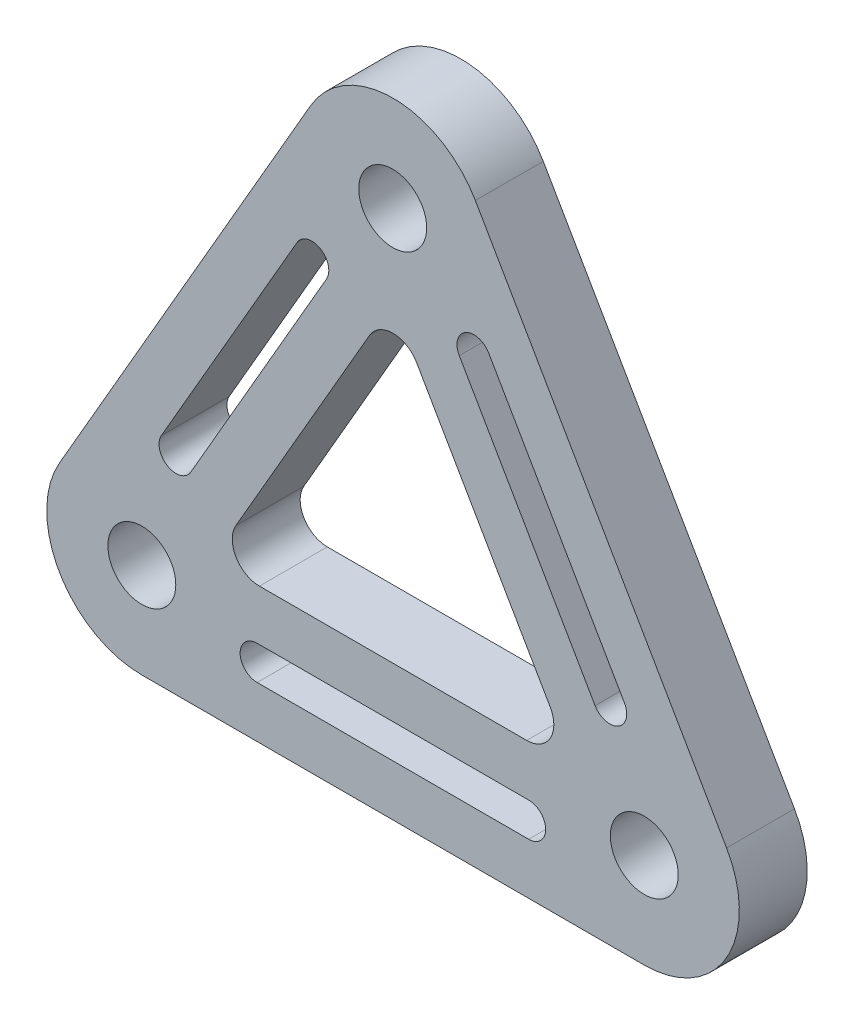
from build123d import *

# Parameters (mm, degrees)
SKETCH1_R           = 4.7625
BOSS_EXTRUDE1_DEPTH = 6.35
BOSS_EXTRUDE2_START = -6.35
SKETCH2_R           = 4.7625
SKETCH2_R_2         = 3.175
BOSS_EXTRUDE2_DEPTH = 6.35
CUT_EXTRUDE1_DEPTH  = 6.35


with BuildPart() as part:
    # Sketch1 → Boss-Extrude1 (new body)
    with BuildSketch(Plane.XY):
        with BuildLine():
            Line((31.405613519, -6.275848049), (7.910613519, -46.970381773))
            ThreePointArc((7.910613519, -46.970381773), (7.910613519, -55.860381773), (15.609579358, -60.305381773))
            Line((15.609579358, -60.305381773), (62.599579358, -60.305381773))
            ThreePointArc((62.599579358, -60.305381773), (70.298545198, -55.860381773), (70.298545198, -46.970381773))
            Line((70.298545198, -46.970381773), (46.803545198, -6.275848049))
            ThreePointArc((46.803545198, -6.275848049), (39.104579358, -1.830848049), (31.405613519, -6.275848049))
        make_face()
        with Locations((39.073094298, -10.775381773)):
            Circle(SKETCH1_R, mode=Mode.SUBTRACT)
        with Locations((15.609579358, -51.415381773)):
            Circle(SKETCH1_R, mode=Mode.SUBTRACT)
        with Locations((62.599579358, -51.415381773)):
            Circle(SKETCH1_R, mode=Mode.SUBTRACT)
        with BuildLine():
            Line((36.904874833, -22.150848049), (24.408397461, -43.795381773))
            ThreePointArc((24.408397461, -43.795381773), (24.408397461, -46.335381773), (26.608101987, -47.605381773))
            Line((26.608101987, -47.605381773), (51.60105673, -47.605381773))
            ThreePointArc((51.60105673, -47.605381773), (53.800761256, -46.335381773), (53.800761256, -43.795381773))
            Line((53.800761256, -43.795381773), (41.304283884, -22.150848049))
            ThreePointArc((41.304283884, -22.150848049), (39.104579358, -20.880848049), (36.904874833, -22.150848049))
        make_face(mode=Mode.SUBTRACT)
    extrude(amount=BOSS_EXTRUDE1_DEPTH)

    # Sketch2 → Boss-Extrude2 (add)
    # profile 1 of 3: a face of its own
    with BuildSketch(Plane.XY.offset(6.35).offset(BOSS_EXTRUDE2_START)):
        with Locations((39.073094298, -10.775381773)):
            Circle(SKETCH2_R)
        with Locations((39.073094298, -10.775381773)):
            Circle(SKETCH2_R_2, mode=Mode.SUBTRACT)
    # profile 2 of 3: a face of its own
    with BuildSketch(Plane.XY.offset(6.35).offset(BOSS_EXTRUDE2_START)):
        with Locations((62.599579358, -51.415381773)):
            Circle(SKETCH2_R)
        with Locations((62.599579358, -51.415381773)):
            Circle(SKETCH2_R_2, mode=Mode.SUBTRACT)
    # profile 3 of 3: a face of its own
    with BuildSketch(Plane.XY.offset(6.35).offset(BOSS_EXTRUDE2_START)):
        with Locations((15.609579358, -51.415381773)):
            Circle(SKETCH2_R)
        with Locations((15.609579358, -51.415381773)):
            Circle(SKETCH2_R_2, mode=Mode.SUBTRACT)
    extrude(amount=BOSS_EXTRUDE2_DEPTH)

    # Sketch3 → Cut-Extrude1 (cut)
    with BuildSketch(Plane.XY.offset(6.35)):
        with BuildLine():
            Line((30.132559504, -18.005842283), (17.432559504, -40.002887539))
            ThreePointArc((17.432559504, -40.002887539), (18.013624833, -42.171452868), (20.182190161, -41.590387539))
            Line((20.182190161, -41.590387539), (32.882190161, -19.593342283))
            ThreePointArc((32.882190161, -19.593342283), (33.040782082, -18.388717049), (32.301124833, -17.424776955))
            ThreePointArc((32.301124833, -17.424776955), (31.096499599, -17.266185034), (30.132559504, -18.005842283))
        make_face()
        with BuildLine():
            Line((60.748040695, -40.002887539), (48.048040695, -18.005842283))
            ThreePointArc((48.048040695, -18.005842283), (45.879475366, -17.424776955), (45.298410038, -19.593342283))
            Line((45.298410038, -19.593342283), (57.998410038, -41.590387539))
            ThreePointArc((57.998410038, -41.590387539), (60.166975366, -42.171452868), (60.748040695, -40.002887539))
        make_face()
        with BuildLine():
            Line((26.390300099, -55.518149371), (51.790300099, -55.518149371))
            ThreePointArc((51.790300099, -55.518149371), (53.377800099, -53.930649371), (51.790300099, -52.343149371))
            Line((51.790300099, -52.343149371), (26.390300099, -52.343149371))
            ThreePointArc((26.390300099, -52.343149371), (24.802800099, -53.930649371), (26.390300099, -55.518149371))
        make_face()
    extrude(amount=-CUT_EXTRUDE1_DEPTH, mode=Mode.SUBTRACT)


solid = part.part
